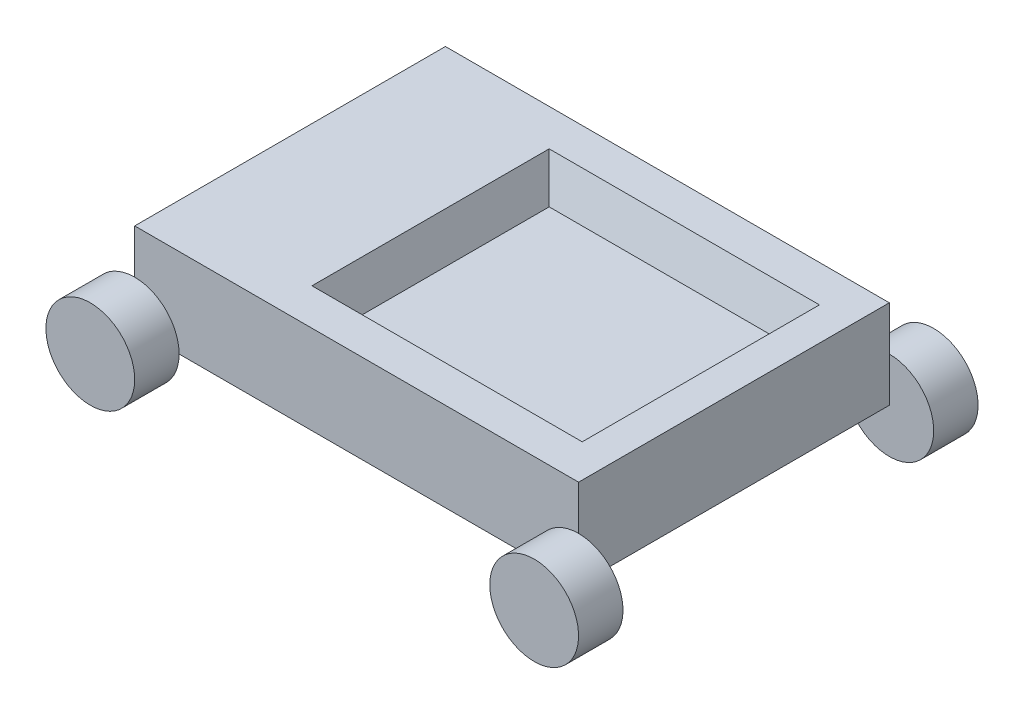
from build123d import *

# Parameters (mm, degrees)
SKETCH_1_W               = 1000
SKETCH_1_H               = 700
EXTRUDE_1_DEPTH          = 200
SKETCH_2_R               = 100
EXTRUDE_2_DEPTH          = 100
MIRROR_2_COPY_1_SKETCH_R = 100
MIRROR_2_COPY_1_DEPTH    = 100
SKETCH_3_W               = 608.816937559
SKETCH_3_H               = 534.376438644
CUT_EXTRUDE_1_DEPTH      = 83
CUT_EXTRUDE_1_DRAFT      = -20


with BuildPart() as part:
    # 草图1 → 凸台-拉伸1 (new body)
    with BuildSketch(Plane(origin=(0, 0, 0), x_dir=(1, 0, 0), z_dir=(0, 1, 0))):
        Rectangle(SKETCH_1_W, SKETCH_1_H)
    extrude(amount=EXTRUDE_1_DEPTH)

    # 草图2 → 凸台-拉伸2 (add)
    with BuildSketch(Plane.XY.offset(350)):
        with Locations((-500, 0)):
            Circle(SKETCH_2_R)
    extrude_2 = extrude(amount=EXTRUDE_2_DEPTH)

    # 镜向1: 凸台-拉伸2 across plane
    add(extrude_2.mirror(Plane(origin=(0, 0, 0), x_dir=(0, 0, 1), z_dir=(1, 0, 0))))

    # 镜向2: 凸台-拉伸2 across plane
    add(extrude_2.mirror(Plane.XY))

    # 镜向2 copy 1 sketch → 镜向2 copy 1 (add)
    with BuildSketch(Plane(origin=(0, 0, -350), x_dir=(-1, 0, 0), z_dir=(0, 0, -1))):
        with Locations((-500, 0)):
            Circle(MIRROR_2_COPY_1_SKETCH_R)
    extrude(amount=MIRROR_2_COPY_1_DEPTH)


with BuildPart() as cut_extrude_1_tool:
    # 草图3 → 切除-拉伸1 (with draft: the straight prism first)
    with BuildSketch(Plane(origin=(0, 200, 0), x_dir=(1, 0, 0), z_dir=(0, 1, 0))):
        with Locations((120.965810738, 0)):
            Rectangle(SKETCH_3_W, SKETCH_3_H)
    extrude(amount=-CUT_EXTRUDE_1_DEPTH)
    # 切除-拉伸1: the draft: its side faces are tilted about the plane it starts from
    cut_extrude_1_sides = [cut_extrude_1_tool.faces().sort_by_distance(p)[0] for p in [
        (120.965810738, 158.5, 267.188219322),
        (425.374279517, 158.5, 0),
        (120.965810738, 158.5, -267.188219322),
        (-183.442658042, 158.5, 0),
    ]]
    draft(cut_extrude_1_sides, Plane(origin=(0, 200, 0), x_dir=(1, 0, 0), z_dir=(0, 1, 0)), CUT_EXTRUDE_1_DRAFT)


with BuildPart() as part_1:
    add(part.part)

    # 切除-拉伸1: cut by cut_extrude_1_tool
    add(cut_extrude_1_tool.part, mode=Mode.SUBTRACT)


solid = part_1.part
